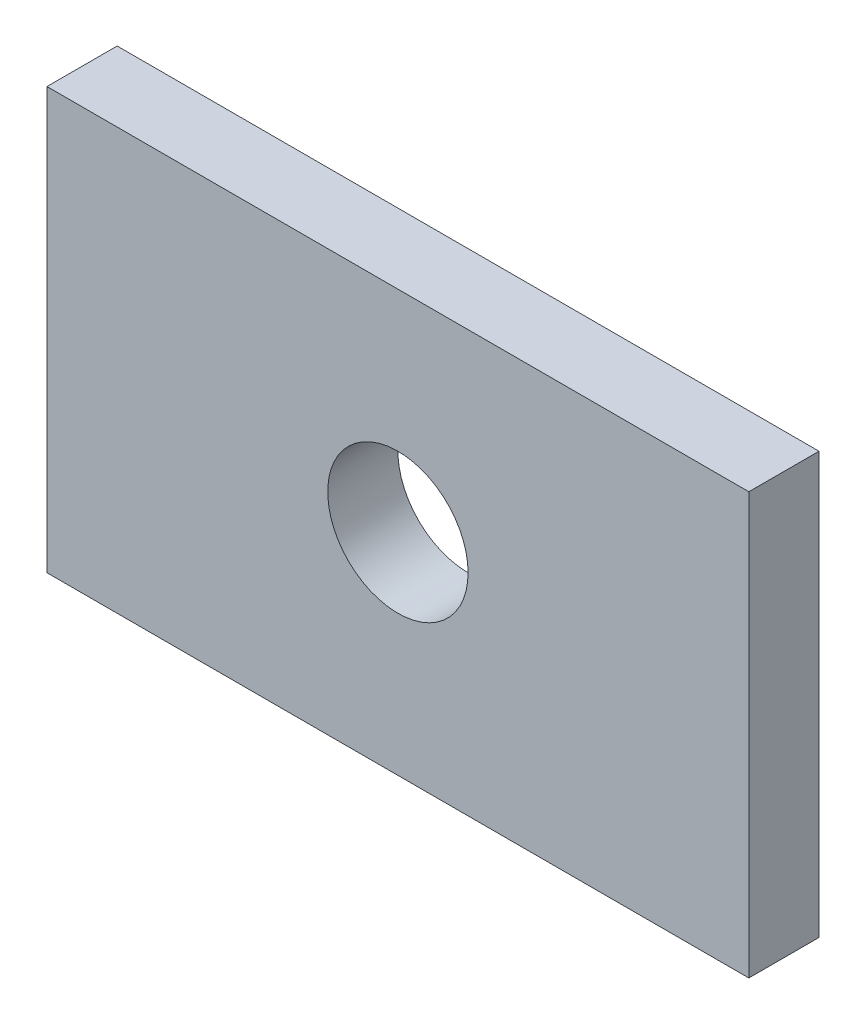
from build123d import *

# Parameters (mm, degrees)
SKETCH1_W           = 100
SKETCH1_H           = 60
SKETCH1_R           = 10
BOSS_EXTRUDE1_DEPTH = 10


with BuildPart() as part:
    # Sketch1 → Boss-Extrude1 (new body)
    with BuildSketch(Plane.XY):
        Rectangle(SKETCH1_W, SKETCH1_H)
        Circle(SKETCH1_R, mode=Mode.SUBTRACT)
    extrude(amount=BOSS_EXTRUDE1_DEPTH)


solid = part.part
